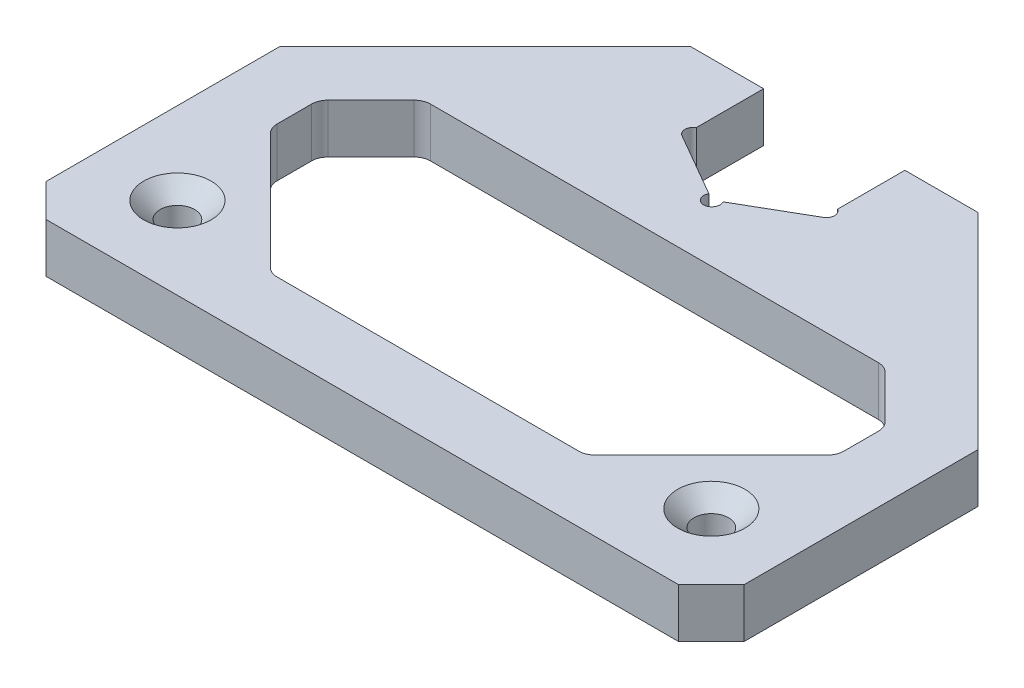
from build123d import *

# Parameters (mm, degrees)
SKETCH_1_R          = 2.1
EXTRUDE_1_DEPTH     = 3
CHAMFER_1_SIZE      = 25
SKETCH_4_R          = 1
CUT_EXTRUDE_1_DEPTH = 68.812240783
CUT_EXTRUDE_2_DEPTH = 68.812240783
CHAMFER_2_SIZE      = 4
FILLET_1_R          = 2
CHAMFER_3_SIZE      = 2


with BuildPart() as part:
    # 草图1 → 凸台-拉伸1 (new, symmetric)
    with BuildSketch(Plane(origin=(0, 0, 0), x_dir=(1, 0, 0), z_dir=(0, 1, 0))):
        Polygon((-8.6, 4.965212315), (-8.6, -4.965212315), (0, -9.93042463), (8.6, -4.965212315), (8.6, 4.965212315), (42.5, 4.965212315), (42.5, -52.5), (-42.5, -52.5), (-42.5, 4.965212315), align=None)
        with Locations(Location((-32.5, -42.5, 0), (0, 0, 270))):
            Circle(SKETCH_1_R, mode=Mode.SUBTRACT)
        with Locations(Location((32.5, -42.5, 0), (0, 0, 270))):
            Circle(SKETCH_1_R, mode=Mode.SUBTRACT)
    extrude(amount=EXTRUDE_1_DEPTH, both=True)

    # 倒角1
    chamfer_1_edges = [part.edges().sort_by_distance(p)[0] for p in [
        (42.5, 0, -4.965212315),
        (-42.5, 0, -4.965212315),
    ]]
    chamfer(chamfer_1_edges, length=CHAMFER_1_SIZE)

    # 草图4 → 切除-拉伸1 (cut, through all)
    with BuildSketch(Plane(origin=(0, 3, 0), x_dir=(1, 0, 0), z_dir=(0, 1, 0))):
        with Locations((0, -9.93042463)):
            Circle(SKETCH_4_R)
        with Locations((-8.1, -4.099186911)):
            Circle(SKETCH_4_R)
        with Locations((8.1, -4.099186911)):
            Circle(SKETCH_4_R)
    extrude(amount=-CUT_EXTRUDE_1_DEPTH, mode=Mode.SUBTRACT)

    # 草图3 → 切除-拉伸2 (cut, through all)
    with BuildSketch(Plane(origin=(0, 3, 0), x_dir=(1, 0, 0), z_dir=(0, 1, 0))):
        Polygon((-28.081928446, -16.93042463), (-34.5, -23.348496184), (-34.5, -29.186291501), (-19.186291501, -44.5), (19.186291501, -44.5), (34.5, -29.186291501), (34.5, -23.348496184), (28.081928446, -16.93042463), align=None)
    extrude(amount=-CUT_EXTRUDE_2_DEPTH, mode=Mode.SUBTRACT)

    # 倒角2
    chamfer_2_edges = [part.edges().sort_by_distance(p)[0] for p in [
        (42.5, 0, 52.5),
        (-42.5, 0, 52.5),
    ]]
    chamfer(chamfer_2_edges, length=CHAMFER_2_SIZE)

    # 圆角1
    fillet_1_edges = [part.edges().sort_by_distance(p)[0] for p in [
        (-28.081928446, 0, 16.93042463),
        (28.081928446, 0, 16.93042463),
        (34.5, 0, 23.348496184),
        (34.5, 0, 29.186291501),
        (19.186291501, 0, 44.5),
        (-19.186291501, 0, 44.5),
        (-34.5, 0, 29.186291501),
        (-34.5, 0, 23.348496184),
    ]]
    fillet(fillet_1_edges, radius=FILLET_1_R)

    # 倒角3
    chamfer_3_edges = [part.edges().sort_by_distance(p)[0] for p in [
        (-32.5, 3, 40.4),
        (32.5, 3, 40.4),
    ]]
    chamfer(chamfer_3_edges, length=CHAMFER_3_SIZE)


solid = part.part
